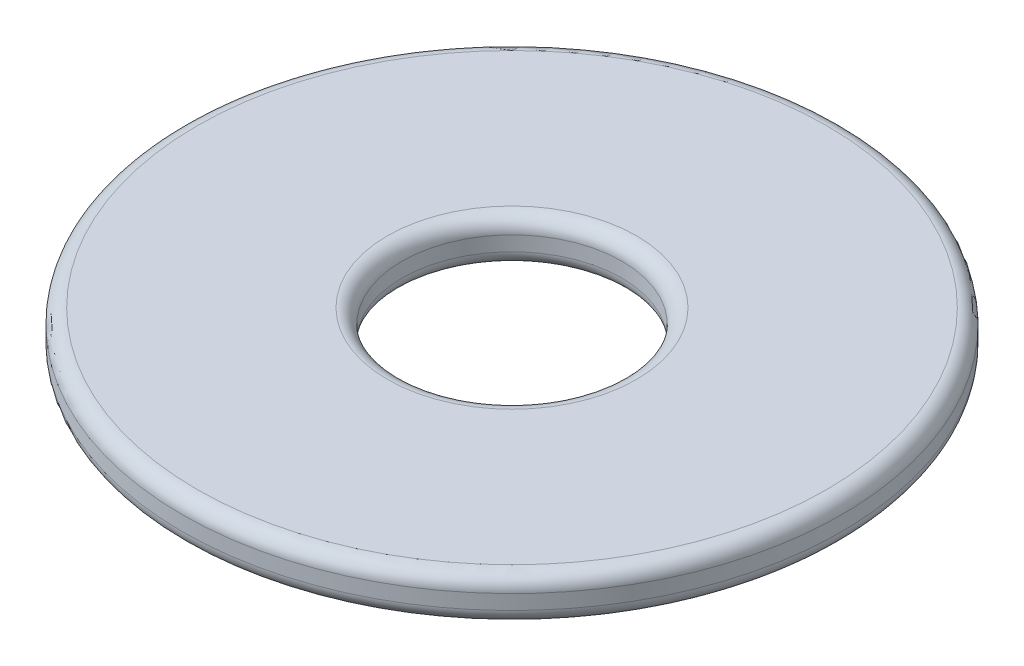
from build123d import *

# Parameters (mm, degrees)
SKETCH1_R           = 9
SKETCH1_R_2         = 3
BOSS_EXTRUDE1_DEPTH = 1.2
FILLET1_R           = 0.4


with BuildPart() as part:
    # Sketch1 → Boss-Extrude1 (new body)
    with BuildSketch(Plane(origin=(0, 0, 0), x_dir=(1, 0, 0), z_dir=(0, 1, 0))):
        with Locations(Location((0, 0, 0), (0, 0, 270))):
            Circle(SKETCH1_R)
        with Locations(Location((0, 0, 0), (0, 0, 270))):
            Circle(SKETCH1_R_2, mode=Mode.SUBTRACT)
    extrude(amount=BOSS_EXTRUDE1_DEPTH)

    # Fillet1
    fillet1_edges = [part.edges().sort_by_distance(p)[0] for p in [
        (0, 0, -9),
        (0, 1.2, -9),
        (0, 0, -3),
        (0, 1.2, -3),
    ]]
    fillet(fillet1_edges, radius=FILLET1_R)


solid = part.part
